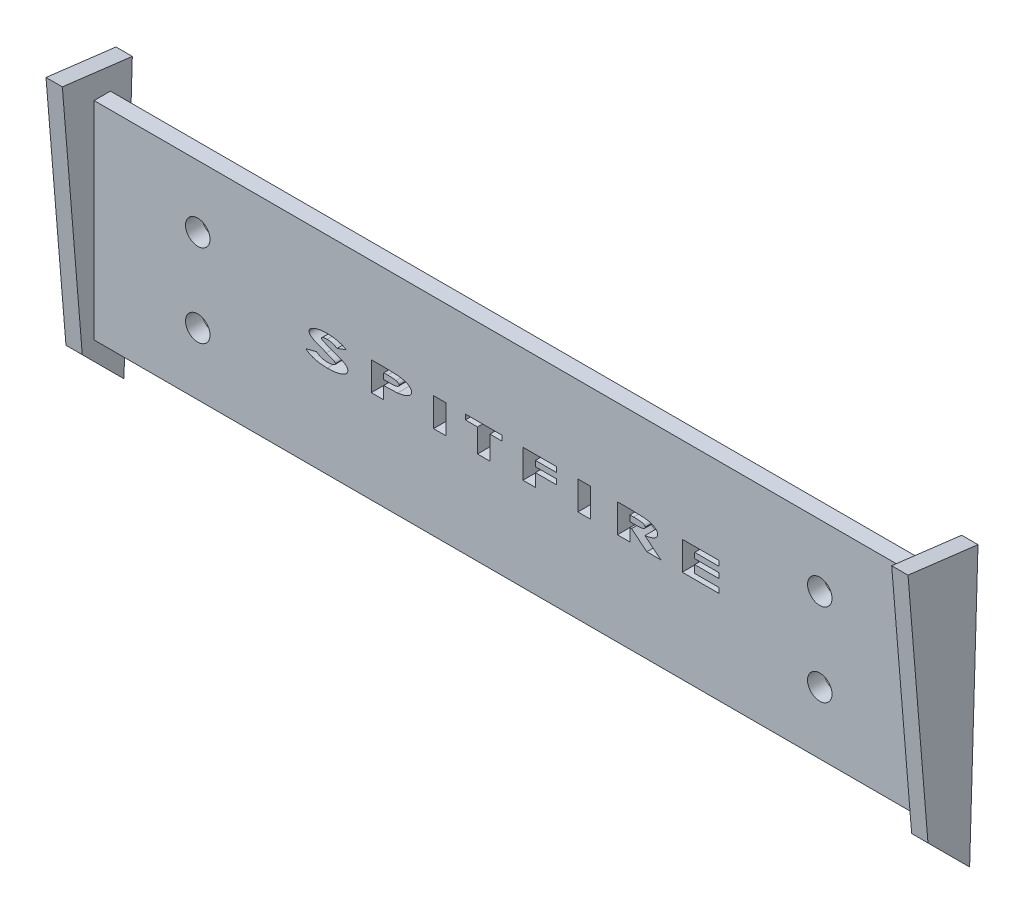
from build123d import *

# Parameters (mm, degrees)
SKETCH1_W           = 101.6
SKETCH1_H           = 25.4
BOSS_EXTRUDE1_DEPTH = 2
BOSS_EXTRUDE2_DEPTH = 2
BOSS_EXTRUDE3_DEPTH = 2
SKETCH7_R           = 1.5
CUT_EXTRUDE1_DEPTH  = 2.54
SKETCH8_W           = 1.525641026
SKETCH8_H           = 3.5
CUT_EXTRUDE2_DEPTH  = 2.54


with BuildPart() as part:
    # Sketch1 → Boss-Extrude1 (new body)
    with BuildSketch(Plane.XY):
        Rectangle(SKETCH1_W, SKETCH1_H)
    extrude(amount=BOSS_EXTRUDE1_DEPTH)

    # Sketch2 → Boss-Extrude2 (add)
    with BuildSketch(Plane.ZY.offset(50.8)):
        Polygon((5.891763356, 16.095479428), (-2.681972418, 15.043487308), (-1.656280102, -18.646560317), (3.445881678, -13.544398538), align=None)
    extrude(amount=BOSS_EXTRUDE2_DEPTH)

    # Sketch3 → Boss-Extrude3 (add)
    with BuildSketch(Plane(origin=(50.8, 0, 0), x_dir=(0, 0, -1), z_dir=(1, 0, 0))):
        Polygon((1.656280102, -18.646560317), (2.681972418, 15.043487308), (-5.891763356, 16.095479428), (-3.445881678, -13.544398538), align=None)
    extrude(amount=BOSS_EXTRUDE3_DEPTH)

    # Sketch7 → Cut-Extrude1 (cut)
    with BuildSketch(Plane.XY.offset(2)):
        with Locations((-38.1, 5.08)):
            Circle(SKETCH7_R)
        with Locations((-38.1, -5.08)):
            Circle(SKETCH7_R)
        with Locations((38.1, -5.08)):
            Circle(SKETCH7_R)
        with Locations((38.1, 5.08)):
            Circle(SKETCH7_R)
    extrude(amount=-CUT_EXTRUDE1_DEPTH, mode=Mode.SUBTRACT)

    # Sketch8 → Cut-Extrude2 (cut)
    # profile 1 of 8: a face of its own
    with BuildSketch(Plane.XY.offset(2)):
        with BuildLine():
            Line((-19.894596158, 1.718589053), (-21.034620197, 1.288801392))
            add(Edge.make_bspline(
                [(-21.034620197, 1.288801392), (-21.084270237, 1.3175243), (-21.182433928, 1.374312706), (-21.334106002, 1.446631808), (-21.486063365, 1.509078065), (-21.6388936, 1.559385161), (-21.792480585, 1.599144517), (-21.946687404, 1.626931965), (-22.101783819, 1.644580969), (-22.205446977, 1.646709482), (-22.257376607, 1.647775751)],
                knots=[0, 0, 0, 0, 1.066712686, 2.109010433, 3.123069128, 4.12123315, 5.099812926, 6.07199732, 7.034175047, 8, 8, 8, 8], degree=3))
            add(Edge.make_bspline(
                [(-22.257376607, 1.647775751), (-22.305553974, 1.647097843), (-22.397671693, 1.645801646), (-22.529010865, 1.6325736), (-22.646709906, 1.610704508), (-22.734665985, 1.584355292), (-22.796822293, 1.560692674), (-22.835872355, 1.541536513), (-22.869495858, 1.523158609), (-22.897130307, 1.504014467), (-22.918402971, 1.483590585), (-22.934103954, 1.462679763), (-22.944354212, 1.440878467), (-22.945377886, 1.425852775), (-22.945878209, 1.418508924)],
                knots=[0, 0, 0, 0, 2.262667849, 4.326342684, 6.19322107, 7.877906412, 8.632279957, 9.314845245, 9.91949747, 10.431296328, 10.88940534, 11.297854018, 11.656824139, 12, 12, 12, 12], degree=3))
            add(Edge.make_bspline(
                [(-22.945878209, 1.418508924), (-22.944170839, 1.403642677), (-22.940520413, 1.371858041), (-22.909973462, 1.328359366), (-22.86539241, 1.28642171), (-22.827268962, 1.263509909), (-22.806354972, 1.250940815)],
                knots=[0, 0, 0, 0, 0.778161636, 1.663740828, 2.718360955, 4, 4, 4, 4], degree=3))
            add(Edge.make_bspline(
                [(-22.806354972, 1.250940815), (-22.797499409, 1.246217825), (-22.777853077, 1.235739729), (-22.745136977, 1.219795419), (-22.706378804, 1.202450266), (-22.662061244, 1.182618426), (-22.611531116, 1.160990083), (-22.55506968, 1.137146695), (-22.492491081, 1.112104886), (-22.424311154, 1.084607723), (-22.350136556, 1.055016102), (-22.269490349, 1.024580205), (-22.18346121, 0.991310536), (-22.09107729, 0.957291713), (-21.993272252, 0.919660661), (-21.888767432, 0.881591723), (-21.778880915, 0.840645602), (-21.703513438, 0.813378107), (-21.66492869, 0.79941838)],
                knots=[0, 0, 0, 0, 0.392260461, 0.870241642, 1.422116371, 2.051880592, 2.767949834, 3.570400471, 4.447378816, 5.402380543, 6.443896078, 7.568651253, 8.771451684, 10.049068747, 11.41649941, 12.867335238, 14.396216952, 16, 16, 16, 16], degree=3))
            add(Edge.make_bspline(
                [(-21.66492869, 0.79941838), (-21.628705471, 0.786326906), (-21.558136803, 0.760822605), (-21.455077043, 0.723648403), (-21.35732081, 0.688544346), (-21.264903964, 0.655166071), (-21.178300616, 0.622467222), (-21.096627639, 0.593487515), (-21.021115306, 0.565108905), (-20.950787382, 0.539509493), (-20.88631446, 0.514503543), (-20.826662807, 0.492593982), (-20.773042673, 0.471071334), (-20.724328294, 0.453253112), (-20.681406052, 0.436209256), (-20.64398801, 0.421071166), (-20.612092369, 0.407455679), (-20.592683056, 0.399303638), (-20.583798882, 0.395572226)],
                knots=[0, 0, 0, 0, 1.60177303, 3.120512025, 4.556217722, 5.921333948, 7.206762179, 8.405807021, 9.525155609, 10.56146452, 11.518146464, 12.400878221, 13.204046699, 13.920697789, 14.557802441, 15.12452116, 15.599269351, 16, 16, 16, 16], degree=3))
            add(Edge.make_bspline(
                [(-20.583798882, 0.395572226), (-20.545602251, 0.3787344), (-20.471821375, 0.34621034), (-20.366510738, 0.29543933), (-20.269400247, 0.245984458), (-20.181486772, 0.196187118), (-20.101590771, 0.147912349), (-20.030507078, 0.099660254), (-19.968375285, 0.051212232), (-19.91331821, 0.004221344), (-19.866739398, -0.043960542), (-19.8265629, -0.092593825), (-19.791763321, -0.141723811), (-19.763310555, -0.192297443), (-19.742312586, -0.244805272), (-19.727023025, -0.298130216), (-19.716353992, -0.352337174), (-19.7155237, -0.388933017), (-19.715108979, -0.407212229)],
                knots=[0, 0, 0, 0, 1.603937938, 3.098177578, 4.491909215, 5.790748845, 6.979789738, 8.078291248, 9.089637123, 10.006275445, 10.857303743, 11.661055789, 12.42841199, 13.168100296, 13.885200733, 14.595748043, 15.298591943, 16, 16, 16, 16], degree=3))
            add(Edge.make_bspline(
                [(-19.715108979, -0.407212229), (-19.715632332, -0.42501065), (-19.716677998, -0.460572118), (-19.725614877, -0.513117592), (-19.738671765, -0.564695955), (-19.758013312, -0.614888186), (-19.782539266, -0.664033325), (-19.812911116, -0.711899247), (-19.848895422, -0.758090862), (-19.889958917, -0.803267125), (-19.936214729, -0.847476978), (-19.988523893, -0.890194221), (-20.045865213, -0.932081718), (-20.108637992, -0.973121038), (-20.177245386, -1.011972932), (-20.251121323, -1.049673629), (-20.32986206, -1.087292167), (-20.444170536, -1.134975846), (-20.59684607, -1.190558706), (-20.791411111, -1.247930003), (-20.999337707, -1.296100798), (-21.220576466, -1.334956523), (-21.454989783, -1.365614298), (-21.702669159, -1.387888514), (-21.96368837, -1.401382713), (-22.142142385, -1.402787058), (-22.233538466, -1.4035063)],
                knots=[0, 0, 0, 0, 0.439564925, 0.878256227, 1.313933482, 1.752662804, 2.204687123, 2.669375231, 3.151123049, 3.649982458, 4.176970639, 4.730871254, 5.31772888, 5.931292408, 6.583211153, 7.265166153, 7.980823904, 8.739231326, 10.325199351, 11.993712875, 13.749171838, 15.597061408, 17.542830852, 19.590032487, 21.741413963, 24, 24, 24, 24], degree=3))
            add(Edge.make_bspline(
                [(-22.233538466, -1.4035063), (-22.305528976, -1.402990365), (-22.446989688, -1.401976557), (-22.65577426, -1.393312523), (-22.857334816, -1.379539721), (-23.052111582, -1.359869076), (-23.239686799, -1.334856106), (-23.420241112, -1.304025201), (-23.593565081, -1.267621713), (-23.760222387, -1.225685322), (-23.920280945, -1.177327279), (-24.074233359, -1.122544465), (-24.222351527, -1.061485569), (-24.365112941, -0.994319012), (-24.501529613, -0.919853666), (-24.632622276, -0.839792359), (-24.757644053, -0.753193121), (-24.836238655, -0.68978185), (-24.875365389, -0.658213832)],
                knots=[0, 0, 0, 0, 1.233342787, 2.423507612, 3.579443188, 4.694209236, 5.776925229, 6.820931269, 7.831603859, 8.810495128, 9.76430159, 10.69513984, 11.608987153, 12.508110787, 13.396796242, 14.270297306, 15.138902499, 16, 16, 16, 16], degree=3))
            Line((-24.875365389, -0.658213832), (-23.55935978, -0.326583223))
            add(Edge.make_bspline(
                [(-23.55935978, -0.326583223), (-23.509441238, -0.362485785), (-23.410524668, -0.433628856), (-23.252983863, -0.524941259), (-23.090001606, -0.602333582), (-22.921309927, -0.665466105), (-22.747122945, -0.714967311), (-22.567441403, -0.749621541), (-22.382013651, -0.771441785), (-22.256502893, -0.774002819), (-22.192873402, -0.775301172)],
                knots=[0, 0, 0, 0, 1.007263314, 1.99595238, 2.979396888, 3.961169174, 4.944501791, 5.943575361, 6.957465837, 8, 8, 8, 8], degree=3))
            add(Edge.make_bspline(
                [(-22.192873402, -0.775301172), (-22.128312901, -0.774227244), (-22.004267511, -0.77216382), (-21.826389778, -0.752756696), (-21.664031697, -0.723258353), (-21.541078558, -0.685367731), (-21.452966248, -0.6514954), (-21.396947708, -0.625015957), (-21.349224276, -0.597805992), (-21.310356418, -0.569094976), (-21.279607543, -0.539598482), (-21.256845748, -0.509194853), (-21.243337973, -0.476740742), (-21.241599976, -0.454531872), (-21.240750004, -0.443670563)],
                knots=[0, 0, 0, 0, 2.176402429, 4.181700718, 6.027277968, 7.732597525, 8.511215191, 9.209235625, 9.820229111, 10.360890437, 10.834623095, 11.252407769, 11.63438797, 12, 12, 12, 12], degree=3))
            add(Edge.make_bspline(
                [(-21.240750004, -0.443670563), (-21.241535249, -0.433557025), (-21.243118005, -0.413171979), (-21.252867774, -0.382612665), (-21.269208485, -0.352600076), (-21.292476909, -0.322672509), (-21.321781099, -0.292966616), (-21.357663367, -0.263213032), (-21.399463034, -0.233237472), (-21.449710771, -0.202965847), (-21.510772033, -0.171115248), (-21.585553551, -0.135241901), (-21.675825452, -0.095537162), (-21.781928325, -0.052340828), (-21.903259037, -0.004733549), (-22.039878927, 0.04721332), (-22.192199812, 0.102378675), (-22.298952392, 0.140198392), (-22.354832536, 0.159995303)],
                knots=[0, 0, 0, 0, 0.371197641, 0.748193292, 1.166337745, 1.619096439, 2.134508283, 2.694432192, 3.327395911, 4.020040861, 4.844731909, 5.85338398, 7.062694429, 8.46237288, 10.05628104, 11.844703166, 13.824890169, 16, 16, 16, 16], degree=3))
            add(Edge.make_bspline(
                [(-22.354832536, 0.159995303), (-22.409315319, 0.179077685), (-22.516054774, 0.216462764), (-22.672054676, 0.272650287), (-22.820861277, 0.326414978), (-22.961978528, 0.379129888), (-23.095585724, 0.430278889), (-23.22211081, 0.479368304), (-23.34118428, 0.526783231), (-23.452649249, 0.573431404), (-23.557196305, 0.617118995), (-23.65392121, 0.660276911), (-23.743715102, 0.700567629), (-23.825833585, 0.739721684), (-23.900117506, 0.777904657), (-23.967618539, 0.813159155), (-24.02716561, 0.847834395), (-24.096139883, 0.889536156), (-24.170645127, 0.94263976), (-24.250897008, 1.005325442), (-24.318211469, 1.068993964), (-24.374005333, 1.132445101), (-24.417267754, 1.196174851), (-24.448050637, 1.260146792), (-24.467582998, 1.324122138), (-24.470222597, 1.367199839), (-24.471519235, 1.388360687)],
                knots=[0, 0, 0, 0, 1.636958732, 3.207032991, 4.701788682, 6.123554791, 7.478640063, 8.758554556, 9.97195586, 11.112845565, 12.184928547, 13.184837297, 14.116134074, 14.975749257, 15.76412899, 16.484539697, 17.134743447, 17.717819325, 18.769449472, 19.726814063, 20.603427931, 21.392698489, 22.118726459, 22.779748981, 23.400582059, 24, 24, 24, 24], degree=3))
            add(Edge.make_bspline(
                [(-24.471519235, 1.388360687), (-24.469691927, 1.418536174), (-24.466015508, 1.479247177), (-24.433404427, 1.56768253), (-24.381758527, 1.651923616), (-24.31001443, 1.732589754), (-24.217970901, 1.808909943), (-24.106522864, 1.882176728), (-23.975175542, 1.95210663), (-23.825648874, 2.017486566), (-23.661507389, 2.077810352), (-23.486205918, 2.131086286), (-23.301393301, 2.17557974), (-23.107494075, 2.212927693), (-22.904121256, 2.24137932), (-22.69147405, 2.261535486), (-22.46948748, 2.273501117), (-22.318389011, 2.275142783), (-22.241250805, 2.27598088)],
                knots=[0, 0, 0, 0, 0.562448596, 1.131607899, 1.73914799, 2.401542499, 3.139243822, 3.967902082, 4.890342933, 5.917074029, 7.015756841, 8.157121995, 9.339452381, 10.567069357, 11.846409792, 13.175986157, 14.558295392, 16, 16, 16, 16], degree=3))
            add(Edge.make_bspline(
                [(-22.241250805, 2.27598088), (-22.141181296, 2.274482157), (-21.943126738, 2.271515929), (-21.649887435, 2.24841273), (-21.363801925, 2.211666363), (-21.129860837, 2.167554447), (-20.943959932, 2.123701845), (-20.802251328, 2.084329616), (-20.657933487, 2.038405454), (-20.510310183, 1.987603992), (-20.360416815, 1.92868531), (-20.206986904, 1.865369009), (-20.051091178, 1.795083979), (-19.947281149, 1.74434153), (-19.894596158, 1.718589053)],
                knots=[0, 0, 0, 0, 1.478744735, 2.92668702, 4.34428105, 5.739721691, 6.442590711, 7.166586569, 7.912662581, 8.680548967, 9.473323239, 10.292422311, 11.133381276, 12, 12, 12, 12], degree=3))
        make_face()
    # profile 2 of 8: a face of its own
    with BuildSketch(Plane.XY.offset(2)):
        with BuildLine():
            Line((-16.843314107, 2.18623729), (-15.166230773, 2.18623729))
            add(Edge.make_bspline(
                [(-15.166230773, 2.18623729), (-15.110374982, 2.1859728), (-15.000766719, 2.185453779), (-14.839500902, 2.185213368), (-14.684319631, 2.1828578), (-14.53498136, 2.180035293), (-14.391461713, 2.176910389), (-14.253841196, 2.171419523), (-14.122218444, 2.167118977), (-13.996732891, 2.160531489), (-13.877071419, 2.153542711), (-13.763471482, 2.145986774), (-13.655512771, 2.137362992), (-13.553760085, 2.128810405), (-13.457824626, 2.117583728), (-13.367696262, 2.10777908), (-13.283602042, 2.095617679), (-13.180588096, 2.079023544), (-13.059578316, 2.055598171), (-12.920821825, 2.024713754), (-12.790681016, 1.987552332), (-12.667346677, 1.94911466), (-12.552652974, 1.90469268), (-12.445485313, 1.857145863), (-12.34648818, 1.805424247), (-12.255954574, 1.749506284), (-12.174903611, 1.690139679), (-12.103047552, 1.628706048), (-12.043193831, 1.562964211), (-11.993342725, 1.494881718), (-11.955157128, 1.42325983), (-11.927229961, 1.348899699), (-11.910825882, 1.271285463), (-11.908556105, 1.218529991), (-11.907416671, 1.192046585)],
                knots=[0, 0, 0, 0, 1.46340507, 2.871703819, 4.225007106, 5.529431833, 6.785016064, 7.985885306, 9.137803243, 10.235201185, 11.277907135, 12.278222961, 13.217915911, 14.115407799, 14.953182756, 15.748369078, 16.49046316, 17.178992211, 18.481921532, 19.719218119, 20.90176201, 22.02680859, 23.10252054, 24.12210246, 25.097118562, 26.026541774, 26.907080823, 27.727308811, 28.498755715, 29.231188026, 29.932449713, 30.618278159, 31.306371467, 32, 32, 32, 32], degree=3))
            add(Edge.make_bspline(
                [(-11.907416671, 1.192046585), (-11.908693458, 1.162697848), (-11.911232169, 1.104342043), (-11.933942036, 1.019072539), (-11.971164404, 0.938095151), (-12.02258531, 0.861093717), (-12.087788288, 0.787329022), (-12.168888256, 0.719110621), (-12.263169045, 0.653706521), (-12.371697452, 0.593433063), (-12.491783499, 0.53619582), (-12.623063216, 0.483921035), (-12.764731468, 0.436223924), (-12.916672585, 0.393119119), (-13.078787551, 0.353997301), (-13.251075104, 0.318806724), (-13.433748899, 0.288725715), (-13.559433048, 0.273140605), (-13.623762825, 0.265163572)],
                knots=[0, 0, 0, 0, 0.670148229, 1.332494798, 2.002110106, 2.700227877, 3.442270858, 4.245667045, 5.11734724, 6.062590581, 7.080892847, 8.157621997, 9.291594197, 10.497671586, 11.767918769, 13.104213934, 14.517830037, 16, 16, 16, 16], degree=3))
            add(Edge.make_bspline(
                [(-13.623762825, 0.265163572), (-13.644092001, 0.26302768), (-13.686832139, 0.258537172), (-13.753885968, 0.252175439), (-13.827047165, 0.246559228), (-13.906077096, 0.241961105), (-13.991118036, 0.236725939), (-14.082062473, 0.23289513), (-14.179029855, 0.228403343), (-14.281869953, 0.224991673), (-14.390788665, 0.222331165), (-14.50554012, 0.219610543), (-14.626351217, 0.216331588), (-14.753038004, 0.215465946), (-14.885781444, 0.213950734), (-15.024367344, 0.21241345), (-15.169034593, 0.211735393), (-15.267425985, 0.211830001), (-15.317673081, 0.211878315)],
                knots=[0, 0, 0, 0, 0.57871954, 1.216702154, 1.906865477, 2.655978871, 3.457930781, 4.31900949, 5.232968279, 6.206176662, 7.232097126, 8.317548607, 9.455918192, 10.653602928, 11.90421768, 13.214378998, 14.577422654, 16, 16, 16, 16], degree=3))
            Line((-15.317673081, 0.211878315), (-15.317673081, -1.31376271))
            Line((-15.317673081, -1.31376271), (-16.843314107, -1.31376271))
            Line((-16.843314107, -1.31376271), (-16.843314107, 2.18623729))
        make_face()
        with BuildLine():
            Line((-15.317673081, 0.840083444), (-14.798141831, 0.840083444))
            add(Edge.make_bspline(
                [(-14.798141831, 0.840083444), (-14.749063073, 0.840273112), (-14.654876688, 0.840637103), (-14.519317531, 0.841861316), (-14.395434821, 0.844516983), (-14.283264971, 0.84893536), (-14.18272279, 0.853440533), (-14.09392627, 0.859937021), (-14.016480355, 0.866541299), (-13.930685277, 0.877462919), (-13.836944237, 0.894719178), (-13.735989793, 0.9210213), (-13.647731369, 0.953041478), (-13.57230226, 0.99022346), (-13.511058637, 1.032913698), (-13.466593415, 1.081483661), (-13.437749868, 1.135256751), (-13.434609988, 1.17372822), (-13.433057697, 1.192747707)],
                knots=[0, 0, 0, 0, 1.568174814, 3.009463184, 4.331533009, 5.52715911, 6.596277993, 7.547017987, 8.371820871, 9.079454436, 10.309743544, 11.414643343, 12.409268189, 13.304268262, 14.095955076, 14.778110641, 15.395923555, 16, 16, 16, 16], degree=3))
            add(Edge.make_bspline(
                [(-13.433057697, 1.192747707), (-13.434355082, 1.209257704), (-13.436932678, 1.242059148), (-13.45543588, 1.289408596), (-13.487080462, 1.332058271), (-13.529786313, 1.371596774), (-13.585117833, 1.406672866), (-13.652202286, 1.437363731), (-13.730455083, 1.466772554), (-13.787640826, 1.481048689), (-13.817973562, 1.488621104)],
                knots=[0, 0, 0, 0, 0.757833709, 1.505635529, 2.298272001, 3.179557629, 4.165391363, 5.294138826, 6.564744192, 8, 8, 8, 8], degree=3))
            add(Edge.make_bspline(
                [(-13.817973562, 1.488621104), (-13.843860373, 1.494288915), (-13.900235228, 1.506631957), (-13.993028203, 1.51991423), (-14.100355948, 1.531740023), (-14.22265247, 1.541362713), (-14.360111349, 1.548865892), (-14.512508185, 1.554572418), (-14.679879219, 1.55690175), (-14.796271992, 1.557644435), (-14.857036062, 1.558032162)],
                knots=[0, 0, 0, 0, 0.609506166, 1.327348598, 2.155066574, 3.093658943, 4.149176572, 5.322115137, 6.601982087, 8, 8, 8, 8], degree=3))
            Line((-14.857036062, 1.558032162), (-15.317673081, 1.558032162))
            Line((-15.317673081, 1.558032162), (-15.317673081, 0.840083444))
        make_face(mode=Mode.SUBTRACT)
    # profile 3 of 8: a face of its own
    with BuildSketch(Plane.XY.offset(2)):
        with Locations((-8.452288466, 0.43623729)):
            Rectangle(SKETCH8_W, SKETCH8_H)
    # profile 4 of 8: a face of its own
    with BuildSketch(Plane.XY.offset(2)):
        Polygon((-5.311262825, 2.18623729), (-0.824083338, 2.18623729), (-0.824083338, 1.558032162), (-2.304852568, 1.558032162), (-2.304852568, -1.31376271), (-3.830493594, -1.31376271), (-3.830493594, 1.558032162), (-5.311262825, 1.558032162), align=None)
    # profile 5 of 8: a face of its own
    with BuildSketch(Plane.XY.offset(2)):
        Polygon((1.73360897, 2.18623729), (5.816942303, 2.18623729), (5.816942303, 1.558032162), (3.259249996, 1.558032162), (3.259249996, 0.884955239), (5.816942303, 0.884955239), (5.816942303, 0.25675011), (3.259249996, 0.25675011), (3.259249996, -1.31376271), (1.73360897, -1.31376271), align=None)
    # profile 6 of 8: a face of its own
    with BuildSketch(Plane.XY.offset(2)):
        with Locations((9.227198714, 0.43623729)):
            Rectangle(SKETCH8_W, SKETCH8_H)
    # profile 7 of 8: a face of its own
    with BuildSketch(Plane.XY.offset(2)):
        with BuildLine():
            Line((13.310532047, 2.18623729), (14.98761538, 2.18623729))
            add(Edge.make_bspline(
                [(14.98761538, 2.18623729), (15.043938559, 2.185971642), (15.1547153, 2.185449164), (15.317617421, 2.185225931), (15.474433216, 2.182825721), (15.624945074, 2.180150371), (15.769374608, 2.176536214), (15.907523778, 2.172729966), (16.039527949, 2.166523621), (16.165318825, 2.161563913), (16.284954173, 2.154206361), (16.398315323, 2.146635069), (16.50559539, 2.13823382), (16.606567447, 2.129156036), (16.701236488, 2.119404441), (16.789582877, 2.108858463), (16.871943488, 2.097919951), (16.972268729, 2.081023033), (17.090842798, 2.058508102), (17.226562128, 2.027164386), (17.355060877, 1.991560302), (17.476198098, 1.95136332), (17.5903516, 1.907595136), (17.697320646, 1.859079735), (17.79711679, 1.806495506), (17.889426764, 1.750193061), (17.972588131, 1.690389896), (18.045780672, 1.627728016), (18.107741754, 1.562137993), (18.158113188, 1.493241575), (18.198349134, 1.422275977), (18.225355691, 1.347761818), (18.243411818, 1.270964449), (18.245415695, 1.218559141), (18.246429483, 1.192046585)],
                knots=[0, 0, 0, 0, 1.476567305, 2.904120786, 4.270516924, 5.588003125, 6.850492046, 8.058027886, 9.21090539, 10.314814917, 11.358168389, 12.352992619, 13.29326912, 14.179113741, 15.010665081, 15.788090778, 16.511596093, 17.188460004, 18.454941687, 19.6750947, 20.839022141, 21.9491877, 23.01985062, 24.042582963, 25.026480147, 25.97534056, 26.874893293, 27.708901216, 28.497806255, 29.234295467, 29.941852647, 30.628106994, 31.305940723, 32, 32, 32, 32], degree=3))
            add(Edge.make_bspline(
                [(18.246429483, 1.192046585), (18.245186486, 1.164370118), (18.242725595, 1.10957616), (18.223887216, 1.029252586), (18.192588364, 0.952774338), (18.148921287, 0.879908709), (18.094017667, 0.80992517), (18.025354594, 0.744653227), (17.945414687, 0.682196895), (17.852528416, 0.624417764), (17.748649223, 0.568577234), (17.631426899, 0.518115668), (17.502512792, 0.469379319), (17.36051495, 0.42606291), (17.206769485, 0.384395002), (17.040395729, 0.346905628), (16.861532527, 0.312423705), (16.737684313, 0.293270455), (16.673813297, 0.283392739)],
                knots=[0, 0, 0, 0, 0.677863331, 1.342035982, 2.010026103, 2.695709573, 3.417638086, 4.183238386, 5.011657829, 5.899954686, 6.860905617, 7.899628043, 9.025242989, 10.237259909, 11.536410537, 12.928730996, 14.416084782, 16, 16, 16, 16], degree=3))
            Line((16.673813297, 0.283392739), (18.627839739, -1.31376271))
            Line((18.627839739, -1.31376271), (16.910091342, -1.31376271))
            Line((16.910091342, -1.31376271), (15.043004002, 0.211878315))
            Line((15.043004002, 0.211878315), (14.836173073, 0.211878315))
            Line((14.836173073, 0.211878315), (14.836173073, -1.31376271))
            Line((14.836173073, -1.31376271), (13.310532047, -1.31376271))
            Line((13.310532047, -1.31376271), (13.310532047, 2.18623729))
        make_face()
        with BuildLine():
            Line((14.836173073, 0.840083444), (15.349394227, 0.840083444))
            add(Edge.make_bspline(
                [(15.349394227, 0.840083444), (15.412028249, 0.840421949), (15.532164968, 0.841071227), (15.704929119, 0.8440511), (15.862230209, 0.851256935), (16.004345109, 0.860351641), (16.131436374, 0.870827012), (16.243166893, 0.885685345), (16.339965154, 0.901946606), (16.422409551, 0.921669989), (16.492961332, 0.943902164), (16.55330046, 0.970063738), (16.604898487, 0.998967646), (16.647143833, 1.032255378), (16.680206239, 1.069131306), (16.703949708, 1.109565507), (16.717862817, 1.154005771), (16.719796186, 1.184704437), (16.720788457, 1.200460046)],
                knots=[0, 0, 0, 0, 1.979614926, 3.79704884, 5.460633322, 6.955776263, 8.297931151, 9.489893841, 10.517243308, 11.398675336, 12.167182261, 12.85193142, 13.474015106, 14.031187982, 14.543999005, 15.030494258, 15.502416376, 16, 16, 16, 16], degree=3))
            add(Edge.make_bspline(
                [(16.720788457, 1.200460046), (16.718994329, 1.219261467), (16.715325721, 1.25770633), (16.684977597, 1.311555223), (16.637295435, 1.359738279), (16.572758097, 1.403110835), (16.49363437, 1.441370149), (16.40166009, 1.475278093), (16.297035491, 1.501863851), (16.20048742, 1.51930922), (16.112092536, 1.530076871), (16.031687816, 1.537807038), (15.938371967, 1.54369135), (15.832514261, 1.549497061), (15.714000144, 1.553499619), (15.582646739, 1.556297524), (15.438438621, 1.557466857), (15.337942617, 1.557838543), (15.285592143, 1.558032162)],
                knots=[0, 0, 0, 0, 0.572178651, 1.169982314, 1.842261604, 2.633251032, 3.53455124, 4.524923537, 5.625647156, 6.831209186, 7.522626991, 8.34824317, 9.300921636, 10.381579549, 11.590124678, 12.926854306, 14.399134, 16, 16, 16, 16], degree=3))
            Line((15.285592143, 1.558032162), (14.836173073, 1.558032162))
            Line((14.836173073, 1.558032162), (14.836173073, 0.840083444))
        make_face(mode=Mode.SUBTRACT)
    # profile 8 of 8: a face of its own
    with BuildSketch(Plane.XY.offset(2)):
        Polygon((21.252839739, 2.18623729), (25.740019227, 2.18623729), (25.740019227, 1.558032162), (22.778480765, 1.558032162), (22.778480765, 0.884955239), (25.740019227, 0.884955239), (25.740019227, 0.25675011), (22.778480765, 0.25675011), (22.778480765, -0.685557582), (25.740019227, -0.685557582), (25.740019227, -1.31376271), (21.252839739, -1.31376271), align=None)
    extrude(amount=-CUT_EXTRUDE2_DEPTH, mode=Mode.SUBTRACT)


with BuildPart() as cut_extrude2_piece_1:
    # of the separate pieces the step leaves, piece 1, a body of its own (cut_extrude2_pieces)
    add(part.part.solids().sort_by_distance((50.8, -18.646560317, -1.656280102))[0])


with BuildPart() as cut_extrude2_piece_2:
    # of the separate pieces the step leaves, piece 2, a body of its own (cut_extrude2_pieces)
    add(part.part.solids().sort_by_distance((16.720788457, 1.200460046, 0))[0])


with BuildPart() as cut_extrude2_piece_3:
    # of the separate pieces the step leaves, piece 3, a body of its own (cut_extrude2_pieces)
    add(part.part.solids().sort_by_distance((-13.433057697, 1.192747707, 0))[0])


solid = Compound([cut_extrude2_piece_1.part, cut_extrude2_piece_2.part, cut_extrude2_piece_3.part])
